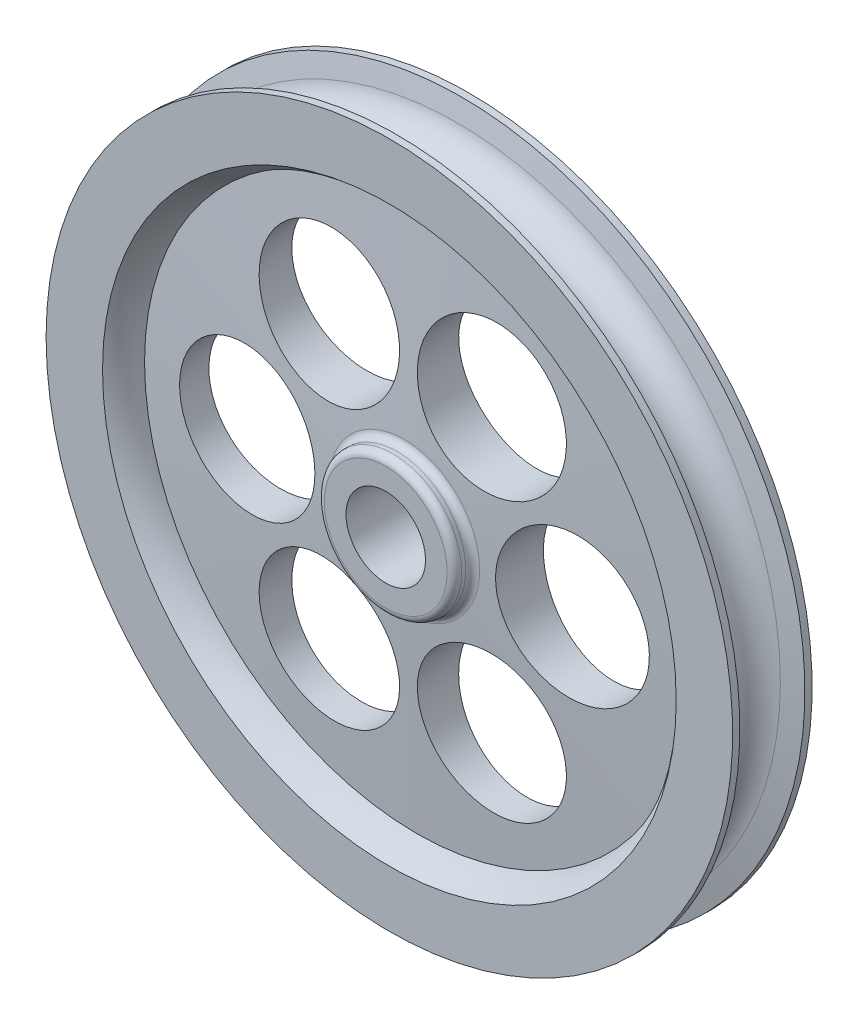
from build123d import *

# Parameters (mm, degrees)
SKETCH3_R          = 20
CUT_EXTRUDE1_DEPTH = 30


with BuildPart() as part:
    # Sketch1 → Revolve2 (revolve)
    with BuildSketch(Plane(origin=(0, 0, 0), x_dir=(1, 0, 0), z_dir=(0, 1, 0)), mode=Mode.PRIVATE) as revolve2_sk:
        with BuildLine():
            ThreePointArc((75.363251617, 15.39), (76.850925857, 19.470187473), (79.381049961, 23))
            Line((79.381049961, 23), (95, 23))
            Line((95, 23), (95, 21))
            Line((95, 21), (89.375169994, 19.83325778))
            ThreePointArc((89.375169994, 19.83325778), (83, 12), (89.375169994, 4.16674222))
            Line((89.375169994, 4.16674222), (95, 3))
            Line((95, 3), (95, 1))
            Line((95, 1), (79.381049961, 1))
            ThreePointArc((79.381049961, 1), (76.850925857, 4.529812527), (75.363251617, 8.61))
            Line((75.363251617, 8.61), (20.87216429, 5.119909922))
            ThreePointArc((20.87216429, 5.119909922), (19.54128971, 4.492270142), (19, 3.123999595))
            Line((19, 3.123999595), (19, 2))
            ThreePointArc((19, 2), (18.414213562, 0.585786438), (17, 0))
            Line((17, 0), (11, 0))
            Line((11, 0), (11, 12))
            Line((11, 12), (11, 24))
            Line((11, 24), (17, 24))
            ThreePointArc((17, 24), (18.414213562, 23.414213562), (19, 22))
            Line((19, 22), (19, 20.876000405))
            ThreePointArc((19, 20.876000405), (19.54128971, 19.507729858), (20.87216429, 18.880090078))
            Line((20.87216429, 18.880090078), (75.363251617, 15.39))
        make_face()
    revolve(revolve2_sk.sketch.rotate(Axis((0, 0, -12), (0, 0, 1)), 180), axis=Axis((0, 0, -12), (0, 0, 1)))

    # Sketch3 → Cut-Extrude1 (cut)
    with BuildSketch(Plane.XY):
        with Locations(Location((45, 0, 0), (0, 0, 225.157179554))):
            Circle(SKETCH3_R)
        with Locations(Location((22.5, -38.97114317, 0), (0, 0, 224.947264384))):
            Circle(SKETCH3_R)
        with Locations(Location((-22.5, -38.97114317, 0), (0, 0, 224.965890733))):
            Circle(SKETCH3_R)
        with Locations((-45, 0)):
            Circle(SKETCH3_R)
        with Locations(Location((-22.5, 38.97114317, 0), (0, 0, 224.955970323))):
            Circle(SKETCH3_R)
        with Locations(Location((22.5, 38.97114317, 0), (0, 0, 234.413004098))):
            Circle(SKETCH3_R)
    extrude(amount=-CUT_EXTRUDE1_DEPTH, mode=Mode.SUBTRACT)


solid = part.part
